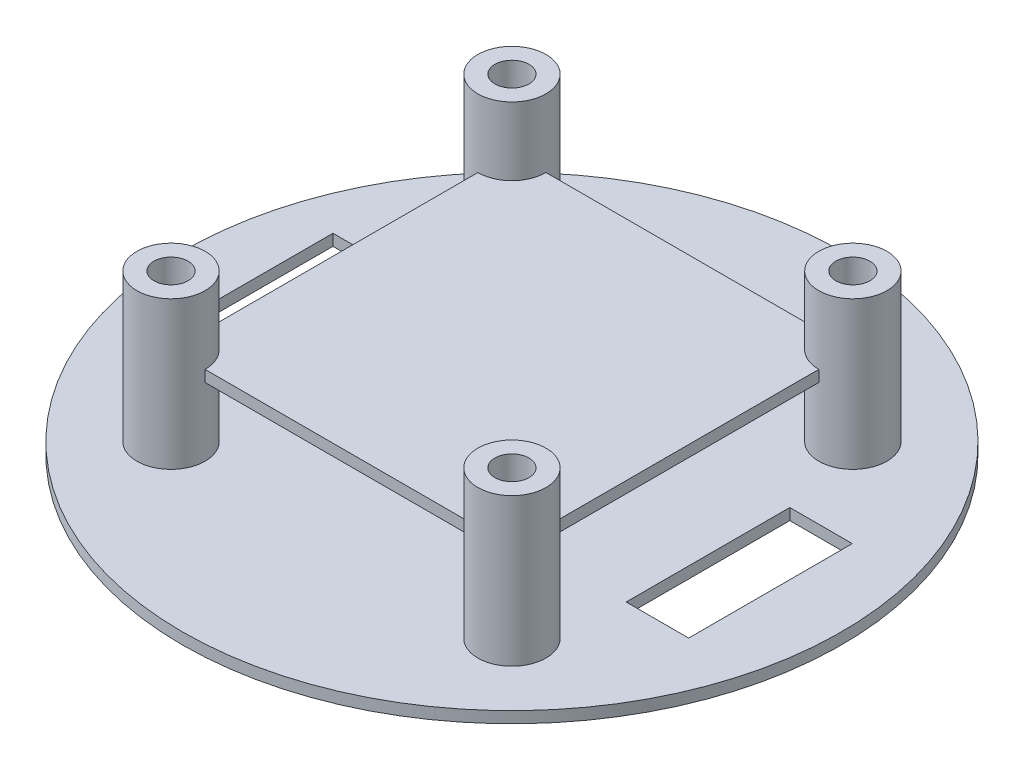
from build123d import *

# Parameters (mm, degrees)
CROQUIS1_R              = 29
SALIENTE_EXTRUIR1_DEPTH = 1
CROQUIS2_R              = 3
SALIENTE_EXTRUIR2_DEPTH = 7
SALIENTE_EXTRUIR3_START = -1
SALIENTE_EXTRUIR3_DEPTH = 1
CROQUIS4_R              = 3
SALIENTE_EXTRUIR4_DEPTH = 6
CROQUIS5_R              = 1.5
CORTAR_EXTRUIR1_DEPTH   = 6
CORTAR_EXTRUIR2_REACH   = 45.336
CROQUIS6_W              = 5.5
CROQUIS6_H              = 14.4
CROQUIS6_W_2            = 7.5
CROQUIS6_H_2            = 16


with BuildPart() as part:
    # Croquis1 → Saliente-Extruir1 (new body)
    with BuildSketch(Plane(origin=(0, 0, 0), x_dir=(1, 0, 0), z_dir=(0, 1, 0))):
        with Locations(Location((0, 0, 0), (0, 0, 270))):
            Circle(CROQUIS1_R)
    extrude(amount=SALIENTE_EXTRUIR1_DEPTH)

    # Croquis2 → Saliente-Extruir2 (add)
    with BuildSketch(Plane(origin=(0, 1, 0), x_dir=(1, 0, 0), z_dir=(0, 1, 0))):
        with Locations(Location((-15, 15, 0), (0, 0, 270))):
            Circle(CROQUIS2_R)
        with Locations(Location((15, 15, 0), (0, 0, 270))):
            Circle(CROQUIS2_R)
        with Locations(Location((-15, -15, 0), (0, 0, 270))):
            Circle(CROQUIS2_R)
        with Locations(Location((15, -15, 0), (0, 0, 270))):
            Circle(CROQUIS2_R)
    extrude(amount=SALIENTE_EXTRUIR2_DEPTH)

    # Croquis3 → Saliente-Extruir3 (add)
    with BuildSketch(Plane(origin=(0, 8, 0), x_dir=(1, 0, 0), z_dir=(0, 1, 0)).offset(SALIENTE_EXTRUIR3_START)):
        with BuildLine():
            Line((-15, -12), (-15, 12))
            ThreePointArc((-15, 12), (-12.878679656, 12.878679656), (-12, 15))
            Line((-12, 15), (12, 15))
            ThreePointArc((12, 15), (12.878679656, 12.878679656), (15, 12))
            Line((15, 12), (15, -12))
            ThreePointArc((15, -12), (12.878679656, -12.878679656), (12, -15))
            Line((12, -15), (-12, -15))
            ThreePointArc((-12, -15), (-12.878679656, -12.878679656), (-15, -12))
        make_face()
    extrude(amount=SALIENTE_EXTRUIR3_DEPTH)

    # Croquis4 → Saliente-Extruir4 (add)
    with BuildSketch(Plane(origin=(0, 8, 0), x_dir=(1, 0, 0), z_dir=(0, 1, 0))):
        with Locations(Location((15, 15, 0), (0, 0, 270))):
            Circle(CROQUIS4_R)
        with Locations(Location((15, -15, 0), (0, 0, 270))):
            Circle(CROQUIS4_R)
        with Locations(Location((-15, 15, 0), (0, 0, 270))):
            Circle(CROQUIS4_R)
        with Locations(Location((-15, -15, 0), (0, 0, 270))):
            Circle(CROQUIS4_R)
    extrude(amount=SALIENTE_EXTRUIR4_DEPTH)

    # Croquis5 → Cortar-Extruir1 (cut)
    with BuildSketch(Plane(origin=(0, 14, 0), x_dir=(1, 0, 0), z_dir=(0, 1, 0))):
        with Locations(Location((15, 15, 0), (0, 0, 270))):
            Circle(CROQUIS5_R)
        with Locations(Location((15, -15, 0), (0, 0, 270))):
            Circle(CROQUIS5_R)
        with Locations(Location((-15, -15, 0), (0, 0, 270))):
            Circle(CROQUIS5_R)
        with Locations(Location((-15, 15, 0), (0, 0, 270))):
            Circle(CROQUIS5_R)
    extrude(amount=-CORTAR_EXTRUIR1_DEPTH, mode=Mode.SUBTRACT)

    # Croquis6 → Cortar-Extruir2 (cut, up to next)
    with BuildSketch(Plane.XZ, mode=Mode.PRIVATE) as cortar_extruir2_sk1:
        with Locations((20, 0)):
            Rectangle(CROQUIS6_W, CROQUIS6_H)
    cortar_extruir2_tool1 = extrude(cortar_extruir2_sk1.sketch, amount=-CORTAR_EXTRUIR2_REACH, mode=Mode.PRIVATE) & part.part
    # Croquis6 → Cortar-Extruir2 (cut, up to next)
    with BuildSketch(Plane.XZ, mode=Mode.PRIVATE) as cortar_extruir2_sk2:
        with Locations((-20, 0)):
            Rectangle(CROQUIS6_W_2, CROQUIS6_H_2)
    cortar_extruir2_tool2 = extrude(cortar_extruir2_sk2.sketch, amount=-CORTAR_EXTRUIR2_REACH, mode=Mode.PRIVATE) & part.part
    add(cortar_extruir2_tool1.solids().sort_by_distance((20, 0, 0))[0], mode=Mode.SUBTRACT)
    add(cortar_extruir2_tool2.solids().sort_by_distance((-20, 0, 0))[0], mode=Mode.SUBTRACT)


solid = part.part
